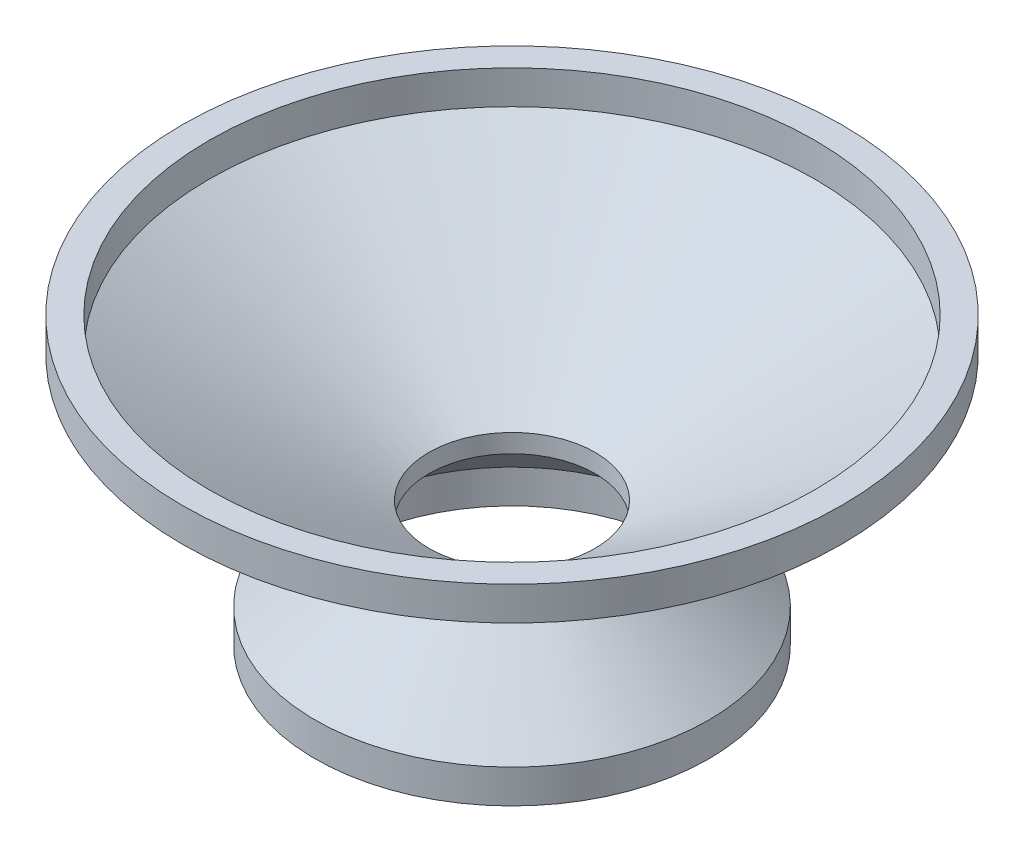
from build123d import *

# Parameters (mm, degrees)
FILLET2_R           = 0.4
SKETCH2_R           = 19.6
SKETCH2_R_2         = 18
BOSS_EXTRUDE1_DEPTH = 2
SKETCH3_R           = 11.702361502
SKETCH3_R_2         = 10.146637676
BOSS_EXTRUDE2_DEPTH = 2


with BuildPart() as part:
    # Sketch1 → Revolve1 (revolve)
    with BuildSketch(Plane.XY):
        Polygon((0.662781953, 0), (-13.193624508, 8), (-11.593624508, 8), (1.462781953, 0.461880215), (1.462781953, -0.634127584), (-3.740262183, -5), (-5.29598601, -5), align=None)
    revolve(axis=Axis((6.406375492, 7.609018033, 0), (0, -1, 0)))

    # Fillet2
    fillet2_edges = [part.edges().sort_by_distance(p)[0] for p in [
        (12.149969032, 0, 0),
    ]]
    fillet(fillet2_edges, radius=FILLET2_R)

    # Sketch2 → Boss-Extrude1 (add)
    with BuildSketch(Plane(origin=(0, 8, 0), x_dir=(1, 0, 0), z_dir=(0, 1, 0))):
        with Locations(Location((6.406375492, 0, 0), (0, 0, 180))):
            Circle(SKETCH2_R)
        with Locations(Location((6.406375492, 0, 0), (0, 0, 180))):
            Circle(SKETCH2_R_2, mode=Mode.SUBTRACT)
    extrude(amount=BOSS_EXTRUDE1_DEPTH)

    # Sketch3 → Boss-Extrude2 (add)
    with BuildSketch(Plane.XZ.offset(5)):
        with Locations((6.406375492, 0)):
            Circle(SKETCH3_R)
        with Locations(Location((6.406375492, 0, 0), (0, 0, 180))):
            Circle(SKETCH3_R_2, mode=Mode.SUBTRACT)
    extrude(amount=BOSS_EXTRUDE2_DEPTH)


solid = part.part
